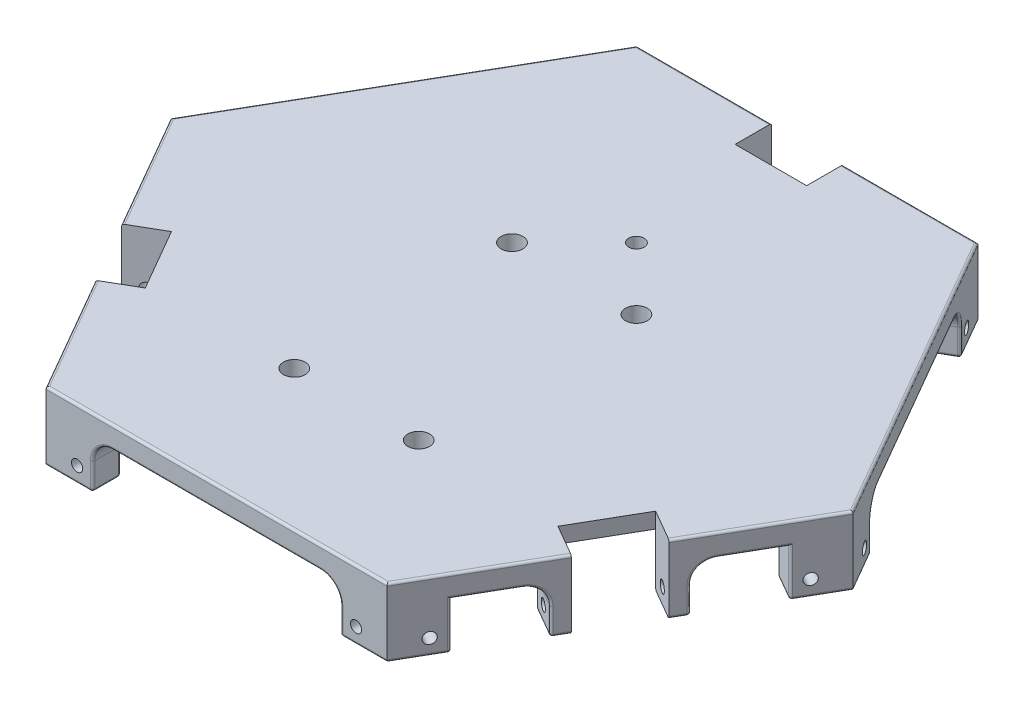
from build123d import *

# Parameters (mm, degrees)
RESSALTO_EXTRUS_O1_DEPTH   = 3
RESSALTO_EXTRUS_O4_DEPTH   = 0.0001
BOSS_EXTRUDE2_DEPTH        = 5
RESSALTO_EXTRUS_O5_DEPTH   = 15
ESBO_O5_R                  = 1.7999999999999936
CORTE_EXTRUS_O1_DEPTH      = 35
PADR_OCIRCULAR1_COUNT      = 3
RESSALTO_EXTRUS_O8_DEPTH   = 15
CORTE_EXTRUS_O2_DEPTH      = 29.00000000000001
CORTE_EXTRUS_O2_DEPTH_BACK = 216.00000000000009
ESBO_O10_R                 = 1.8000000000000007
CORTE_EXTRUS_O3_DEPTH      = 216.00000000000009
CORTE_EXTRUS_O3_DEPTH_BACK = 216.00000000000009
ESBO_O11_R                 = 1.8025814951742
CORTE_EXTRUS_O4_DEPTH      = 216.00000000000009
CORTE_EXTRUS_O4_DEPTH_BACK = 216.00000000000009
ESBO_O12_R                 = 1.80403570182526
CORTE_EXTRUS_O5_DEPTH      = 216.00000000000009
CORTE_EXTRUS_O5_DEPTH_BACK = 216.00000000000009
ESBO_O13_R                 = 1.8049099392984227
CORTE_EXTRUS_O6_DEPTH      = 216.00000000000009
CORTE_EXTRUS_O6_DEPTH_BACK = 216.00000000000009
ESBO_O14_R                 = 1.8000000000000007
CORTE_EXTRUS_O7_DEPTH      = 216.00000000000009
CORTE_EXTRUS_O7_DEPTH_BACK = 216.00000000000009
ESBO_O15_R                 = 1.8000000000000007
BOSS_EXTRUDE3_DEPTH        = 2
FILLET1_R                  = 6.5
FILLET2_R                  = 0.75
FILLET3_R                  = 0.75
ESBO_O16_R                 = 3.500000000000001
ESBO_O16_R_2               = 3.4999999999999996
ESBO_O16_R_3               = 2.500000000000003
CORTE_EXTRUS_O8_DEPTH      = 10


with BuildPart() as part:
    # Esboço1 → Ressalto-extrusão1 (new body)
    with BuildSketch(Plane(origin=(0, 0, 0), x_dir=(1, 0, 0), z_dir=(0, 1, 0))):
        Polygon((-76.52241335952162, -57.459292143521004), (-54.84827557301444, -95.00000000000001), (54.848275573014426, -95.00000000000001), (76.52241335952168, -57.45929214352106), (66.34661486505452, -51.58429214352106), (77.84661486505452, -31.66570785647897), (88.02241335952166, -37.54070785647897), (109.69655114602891, -1.413e-14), (54.848275573014455, 95), (11.499999999999996, 95), (11.49999999999999, 83.25), (-11.50000000000001, 83.25), (-11.499999999999996, 95), (-54.84827557301442, 95), (-109.69655114602888, 1.67e-14), (-88.02241335952161, -37.54070785647894), (-77.84661486505446, -31.665707856478924), (-66.34661486505448, -51.58429214352102), align=None)
    extrude(amount=RESSALTO_EXTRUS_O1_DEPTH)

    # Esboço3 → Ressalto-extrusão4 (add)
    with BuildSketch(Plane(origin=(0, 3, 0), x_dir=(1, 0, 0), z_dir=(0, 1, 0))):
        Polygon((-66.34661486505448, -51.58429214352102), (-60.28443703856341, -48.084292143521004), (-63.284437038563446, -42.88813972081439), (-69.34661486505445, -46.3881397208144), align=None)
        Polygon((-77.84661486505446, -31.665707856478924), (-71.78443703856347, -28.165707856478917), (-68.78443703856344, -33.36186027918553), (-74.84661486505446, -36.86186027918555), align=None)
        Polygon((-11.50000000000001, 83.25), (-11.500000000000009, 75.25000000000001), (-5.500000000000008, 75.25000000000003), (-5.500000000000008, 83.25), align=None)
        Polygon((11.49999999999999, 83.25), (11.499999999999991, 75.25000000000001), (5.499999999999991, 75.25000000000003), (5.499999999999992, 83.25), align=None)
        Polygon((66.34661486505452, -51.58429214352106), (59.418411634779005, -47.58429214352107), (62.418411634779005, -42.38813972081444), (69.34661486505452, -46.388139720814436), align=None)
        Polygon((77.8466148650545, -31.665707856478967), (70.91841163477902, -27.665707856478974), (67.91841163477903, -32.8618602791856), (74.84661486505455, -36.86186027918559), align=None)
    extrude(amount=-RESSALTO_EXTRUS_O4_DEPTH)

    # Sketch5 → Boss-Extrude2 (add)
    with BuildSketch(Plane(origin=(0, 3, 0), x_dir=(1, 0, 0), z_dir=(0, 1, 0))):
        Polygon((77.84661486505452, -31.66570785647897), (88.02241335952166, -37.54070785647897), (109.69655114602891, -1.413e-14), (54.848275573014455, 95), (11.499999999999996, 95), (11.49999999999999, 83.25), (20.499999999999996, 83.25), (20.499999999999996, 86), (49.65212315030783, 86), (99.30424630061566, -1.691e-14), (84.72818472546173, -25.246479222419026), (82.34661486505452, -23.871479222419023), align=None)
        Polygon((-11.50000000000001, 83.25), (-11.499999999999996, 95), (-54.84827557301442, 95), (-109.69655114602888, 1.67e-14), (-88.02241335952161, -37.54070785647894), (-77.84661486505446, -31.665707856478924), (-82.34661486505449, -23.871479222418984), (-84.72818472546165, -25.246479222418962), (-99.30424630061557, -4.337e-14), (-49.6521231503078, 86), (-20.50000000000001, 86), (-20.50000000000001, 83.25), align=None)
        Polygon((-66.34661486505448, -51.58429214352102), (-76.52241335952162, -57.459292143521004), (-54.84827557301444, -95.00000000000001), (54.848275573014426, -95.00000000000001), (76.52241335952168, -57.45929214352106), (66.34661486505452, -51.58429214352106), (61.84661486505451, -59.378520777580995), (64.22818472546174, -60.75352077758099), (49.65212315030781, -86.00000000000001), (-49.6521231503078, -86.00000000000001), (-64.22818472546169, -60.75352077758097), (-61.84661486505446, -59.37852077758095), align=None)
    extrude(amount=-BOSS_EXTRUDE2_DEPTH)

    # Esboço4 → Ressalto-extrusão5 (add)
    with BuildSketch(Plane.XZ.offset(2)):
        Polygon((-76.52241335952162, 57.45929214352102), (-74.02241335952165, 61.78941916244322), (-63.846614865054484, 55.91441916244322), (-66.34661486505448, 51.58429214352102), align=None)
        Polygon((-77.84661486505448, 31.665707856478917), (-88.02241335952162, 37.54070785647897), (-90.52241335952166, 33.21058083755671), (-80.34661486505449, 27.3355808375567), align=None)
    ressalto_extrus_o5 = extrude(amount=RESSALTO_EXTRUS_O5_DEPTH)

    # Esboço5 → Corte-extrusão1 (cut)
    with BuildSketch(Plane(origin=(-8.250000000000057, 0, -14.289419162443316), x_dir=(-0.8660254037844386, 0, 0.5000000000000003), z_dir=(-0.5000000000000002, 0, -0.8660254037844385))):
        with Locations((89.12499999999996, -12)):
            Circle(ESBO_O5_R)
    corte_extrus_o1 = extrude(amount=-CORTE_EXTRUS_O1_DEPTH, mode=Mode.SUBTRACT)

    # PadrãoCircular1: Ressalto-extrusão5, Corte-extrusão1 ×3 about axis
    padr_ocircular1_axis = Axis((0, 0, 0), (0, -1, 0))
    add([ressalto_extrus_o5.rotate(padr_ocircular1_axis, i * 360 / PADR_OCIRCULAR1_COUNT) for i in range(1, PADR_OCIRCULAR1_COUNT)])
    add([corte_extrus_o1.rotate(padr_ocircular1_axis, i * 360 / PADR_OCIRCULAR1_COUNT) for i in range(1, PADR_OCIRCULAR1_COUNT)], mode=Mode.SUBTRACT)

    # Esboço9 → Ressalto-extrusão8 (add)
    with BuildSketch(Plane.XZ.offset(2)):
        Polygon((-54.84827557301444, 95.00000000000001), (-39.84827557301444, 95.00000000000001), (-39.84827557301444, 86.00000000000001), (-49.65212315030776, 86.00000000000001), (-54.55404693895444, 77.50961894323342), (-62.34827557301441, 82.00961894323343), align=None)
        Polygon((54.848275573014426, 95.00000000000001), (62.34827557301445, 82.00961894323342), (54.55404693895453, 77.50961894323342), (49.65212315030783, 86.00000000000001), (39.84827557301443, 86.00000000000001), (39.84827557301443, 95.00000000000001), align=None)
        Polygon((109.69655114602891, 1.413e-14), (102.1965511460289, 12.990381056766584), (94.40232251196895, 8.490381056766584), (99.30424630061572, -9.085e-14), (94.40232251196873, -8.490381056767017), (102.19655114602891, -12.990381056766573), align=None)
        Polygon((54.848275573014455, -95), (39.84827557301443, -95), (39.84827557301443, -86.00000000000001), (49.65212315030783, -86.00000000000003), (54.554046938954514, -77.5096189432334), (62.34827557301446, -82.00961894323342), align=None)
        Polygon((-54.84827557301442, -95), (-62.34827557301441, -82.00961894323345), (-54.554046938954414, -77.5096189432334), (-49.65212315030775, -86.00000000000001), (-39.84827557301444, -86.00000000000001), (-39.84827557301444, -95), align=None)
        Polygon((-109.69655114602888, -1.67e-14), (-102.19655114602885, 12.99038105676659), (-94.40232251196892, 8.490381056766584), (-99.30424630061563, -1.664e-14), (-94.40232251196892, -8.490381056767017), (-102.19655114602868, -12.990381056766926), align=None)
    extrude(amount=RESSALTO_EXTRUS_O8_DEPTH)

    # Esboço10 → Corte-extrusão2 (cut, two sides: drawn at the far end of the back side and taken through both)
    with BuildSketch(Plane.XY.offset(95.00000000000001).offset(-CORTE_EXTRUS_O2_DEPTH_BACK)):
        with Locations((44.848275573014426, -12)):
            Circle(ESBO_O10_R)
    extrude(amount=CORTE_EXTRUS_O2_DEPTH + CORTE_EXTRUS_O2_DEPTH_BACK, mode=Mode.SUBTRACT)

    # Esboço11 → Corte-extrusão3 (cut, two sides: drawn at the far end of the back side and taken through both)
    with BuildSketch(Plane(origin=(82.27241335952168, 0, 47.50000000000006), x_dir=(0.5000000000000006, 0, -0.8660254037844384), z_dir=(0.8660254037844384, 0, 0.5000000000000006)).offset(-CORTE_EXTRUS_O3_DEPTH_BACK)):
        with Locations((-44.84827557301439, -12)):
            Circle(ESBO_O11_R)
    extrude(amount=CORTE_EXTRUS_O3_DEPTH + CORTE_EXTRUS_O3_DEPTH_BACK, mode=Mode.SUBTRACT)

    # Esboço12 → Corte-extrusão4 (cut, two sides: drawn at the far end of the back side and taken through both)
    with BuildSketch(Plane(origin=(82.27241335952168, 0, 47.500000000000064), x_dir=(0.5000000000000007, 0, -0.8660254037844383), z_dir=(0.8660254037844383, 0, 0.5000000000000007)).offset(-CORTE_EXTRUS_O4_DEPTH_BACK)):
        with Locations((44.8482755730145, -12)):
            Circle(ESBO_O12_R)
    extrude(amount=CORTE_EXTRUS_O4_DEPTH + CORTE_EXTRUS_O4_DEPTH_BACK, mode=Mode.SUBTRACT)

    # Esboço13 → Corte-extrusão5 (cut, two sides: drawn at the far end of the back side and taken through both)
    with BuildSketch(Plane(origin=(82.27241335952168, 0, -47.50000000000001), x_dir=(-0.5, 0, -0.8660254037844386), z_dir=(0.8660254037844387, 0, -0.5000000000000001)).offset(-CORTE_EXTRUS_O5_DEPTH_BACK)):
        with Locations((-44.84827557301447, -12)):
            Circle(ESBO_O13_R)
    extrude(amount=CORTE_EXTRUS_O5_DEPTH + CORTE_EXTRUS_O5_DEPTH_BACK, mode=Mode.SUBTRACT)

    # Esboço14 → Corte-extrusão6 (cut, two sides: drawn at the far end of the back side and taken through both)
    with BuildSketch(Plane(origin=(82.27241335952168, 0, -47.50000000000001), x_dir=(-0.5, 0, -0.8660254037844386), z_dir=(0.8660254037844387, 0, -0.5000000000000001)).offset(-CORTE_EXTRUS_O6_DEPTH_BACK)):
        with Locations((44.84827557301444, -12)):
            Circle(ESBO_O14_R)
    extrude(amount=CORTE_EXTRUS_O6_DEPTH + CORTE_EXTRUS_O6_DEPTH_BACK, mode=Mode.SUBTRACT)

    # Esboço15 → Corte-extrusão7 (cut, two sides: drawn at the far end of the back side and taken through both)
    with BuildSketch(Plane(origin=(0, 0, -95), x_dir=(-1, 0, 0), z_dir=(0, 0, -1)).offset(-CORTE_EXTRUS_O7_DEPTH_BACK)):
        with Locations((44.84827557301443, -12)):
            Circle(ESBO_O15_R)
    extrude(amount=CORTE_EXTRUS_O7_DEPTH + CORTE_EXTRUS_O7_DEPTH_BACK, mode=Mode.SUBTRACT)

    # Sketch6 → Boss-Extrude3 (add)
    with BuildSketch(Plane(origin=(0, 3, 0), x_dir=(1, 0, 0), z_dir=(0, 1, 0))):
        Polygon((-77.84661486505446, -31.665707856478924), (-66.34661486505448, -51.58429214352102), (-76.52241335952162, -57.459292143521004), (-54.84827557301444, -95.00000000000001), (54.848275573014426, -95.00000000000001), (76.52241335952168, -57.45929214352106), (66.34661486505452, -51.58429214352106), (77.84661486505452, -31.66570785647897), (88.02241335952166, -37.54070785647897), (109.69655114602891, -1.413e-14), (54.848275573014455, 95), (11.499999999999996, 95), (11.49999999999999, 83.25), (-11.50000000000001, 83.25), (-11.499999999999996, 95), (-54.84827557301442, 95), (-109.69655114602888, 1.67e-14), (-88.02241335952161, -37.54070785647894), align=None)
    extrude(amount=BOSS_EXTRUDE3_DEPTH)

    # Fillet1
    fillet1_edges = [part.edges().sort_by_distance(p)[0] for p in [
        (-85.43451411228807, -2, 30.273080837556705),
        (-98.29943682899889, -2, 10.740381056766587),
        (-98.29943682899881, -2, -10.74038105676697),
        (-58.45116125598442, -2, -79.75961894323342),
        (-39.84827557301444, -2, -90.5),
        (-16.500000000000014, -2, -89.12499999999996),
        (58.45116125598449, -2, -79.75961894323342),
        (16.500000000000014, -2, -89.12499999999994),
        (39.84827557301443, -2, -90.5),
        (98.29943682899882, -2, -10.740381056766795),
        (85.43451411228807, -2, 30.273080837556705),
        (-39.84827557301444, -2, 90.50000000000001),
        (39.84827557301443, -2, 90.50000000000001),
        (-58.451161255984424, -2, 79.75961894323342),
        (-68.93451411228807, -2, 58.85191916244322),
        (68.93451411228806, -2, 58.85191916244321),
    ]]
    fillet(fillet1_edges, radius=FILLET1_R)

    # Fillet2
    fillet2_edges = [part.edges().sort_by_distance(p)[0] for p in [
        (-102.19655114602885, -12.75, 12.99038105676659),
        (-101.24464818488512, -3.9038059222874413, 14.63912534934277),
        (-96.35948225277525, -2, 23.100480947161643),
        (-90.52241335952166, -12.75, 33.21058083755671),
        (-74.02241335952165, -12.75, 61.78941916244322),
        (-73.07051039837792, -3.9038059222874413, 63.438163455019385),
        (-62.34827557301441, -12.75, 82.00961894323343),
        (-63.30017853415812, -3.9038059222874404, 80.36087465065725),
        (102.19655114602891, -12.75, -12.990381056766573),
        (101.24464818488497, -3.9038059222874404, -14.639125349342624),
        (62.34827557301446, -12.75, -82.00961894323342),
        (63.300178534158164, -3.903805922287443, -80.36087465065722),
        (39.84827557301443, -12.75, -95),
        (37.944469650726994, -3.9038059222874404, -95),
        (16.500000000000018, -12.75, -94.99999999999997),
        (18.40380592228746, -3.9038059222874404, -95),
        (94.40232251196873, -12.75, -8.490381056767017),
        (93.45041955082478, -3.9038059222874404, -10.139125349343065),
        (74.47818472546162, -2, -43.000000000000206),
        (55.50594990009824, -3.9038059222874404, -75.86087465065722),
        (39.84827557301443, -12.75, -86.00000000000001),
        (37.944469650726994, -3.9038059222874404, -86),
        (28.17413778650722, -2, -86),
        (16.500000000000018, -12.75, -83.24999999999994),
        (-16.500000000000007, -12.75, -94.99999999999996),
        (-18.403805922287447, -3.9038059222874413, -95),
        (-39.84827557301444, -12.75, -95),
        (-37.944469650727, -3.9038059222874386, -95),
        (-39.84827557301444, -12.75, -86.00000000000001),
        (-37.944469650727, -3.9038059222874413, -86),
        (-28.174137786507224, -2, -86),
        (-16.500000000000018, -12.75, -83.24999999999994),
        (-62.34827557301441, -12.75, -82.00961894323345),
        (-63.300178534158135, -3.903805922287443, -80.36087465065727),
        (-82.27241335952155, -2, -47.50000000000019),
        (-102.19655114602868, -12.75, -12.990381056766926),
        (-94.40232251196892, -12.75, -8.490381056767017),
        (-54.554046938954414, -12.75, -77.5096189432334),
        (-55.505949900098166, -3.903805922287443, -75.86087465065724),
        (-74.47818472546157, -2, -43.00000000000017),
        (-94.40232251196892, -12.75, 8.490381056766584),
        (-93.45041955082517, -3.9038059222874413, 10.139125349342752),
        (-88.56525361871527, -2, 18.60048094716163),
        (-80.34661486505449, -12.75, 27.3355808375567),
        (-63.846614865054484, -12.75, 55.91441916244322),
        (-54.55404693895444, -12.75, 77.50961894323342),
        (-55.50594990009818, -3.903805922287437, 75.86087465065725),
        (-63.6155621646608, -2.126225608009019, 61.814614178751086),
        (39.84827557301443, -12.75, 86.00000000000001),
        (-39.84827557301444, -12.75, 86.00000000000001),
        (-37.944469650727, -3.9038059222874413, 86.00000000000001),
        (0, -2, 86.00000000000001),
        (63.61556216466084, -2.1262256080090207, 61.81461417875111),
        (63.30077832165249, -4.894448724535993, 56.859835788243295),
        (80.89245140845655, -4.894448724536039, 26.390164211756698),
        (90.52241335952166, -12.75, 33.210580837556705),
        (91.47431632066541, -3.9038059222874413, 31.561836544980544),
        (-39.84827557301444, -12.75, 95.00000000000001),
        (-37.944469650727, -3.9038059222874413, 95.00000000000001),
        (-7.11e-15, -2, 95.00000000000001),
        (37.944469650726994, -3.9038059222874404, 95.00000000000001),
        (66.56034446626806, -2, 74.71410161513775),
        (73.07051039837798, -3.903805922287445, 63.43816345501943),
        (-44.7501993616611, -17, 86.00000000000001),
        (-52.1030850446311, -17, 81.75480947161671),
        (-96.85328440629227, -17, -4.245190528383517),
        (-96.85328440629227, -17, 4.245190528383284),
        (44.75019936166113, -17, -86.00000000000003),
        (52.10308504463117, -17, -81.75480947161671),
        (-52.10308504463109, -17, -81.75480947161671),
        (-44.750199361661096, -17, -86.00000000000001),
        (96.85328440629223, -17, -4.245190528383554),
        (96.85328440629233, -17, 4.2451905283832465),
        (52.10308504463118, -17, 81.75480947161671),
        (44.75019936166113, -17, 86.00000000000001),
        (-91.47431632066534, -3.903805922287436, 31.5618365449805),
        (-68.18534446626802, -2, 71.89951905283831),
        (82.27241335952168, -2, -47.49999999999999),
        (28.174137786507224, -2, -95),
        (54.554046938954514, -12.75, -77.5096189432334),
        (21.725245121601812, -2.1262256080090207, -86),
        (20.499999999999996, -2.500000000000009, -84.625),
        (17.59167308680403, -4.894448724536022, -83.25),
        (14.000000000000004, -17, -83.24999999999994),
        (-14.000000000000014, -17, -83.24999999999994),
        (-28.17413778650722, -2, -95),
        (-20.500000000000014, -2.499999999999999, -84.625),
        (-21.725245121601816, -2.126225608009019, -86),
        (-17.591673086804025, -4.894448724536015, -83.25),
        (-101.24464818488497, -3.903805922287443, -14.639125349343114),
        (-93.45041955082496, -3.9038059222874404, -10.13912534934307),
        (-85.34080728626255, -2.1262256080090225, 24.185385821248833),
        (-83.53739979525805, -2.5000000000000266, 24.558979222419),
        (-80.89245140845651, -4.894448724536027, 26.390164211756673),
        (-63.03739979525807, -2.499999999999991, 60.066020777580974),
        (-63.30077832165246, -4.894448724536001, 56.85983578824326),
        (-60.39111583220808, -2, 67.39951905283831),
        (37.944469650726994, -3.9038059222874404, 86.00000000000001),
        (54.55404693895453, -9.5, 77.50961894323342),
        (58.76611583220812, -2, 70.21410161513775),
        (63.037399795258175, -2.500000000000033, 60.066020777580924),
        (63.84661486505448, -12.75, 55.91441916244321),
        (80.34661486505449, -12.75, 27.335580837556698),
        (62.34827557301445, -9.5, 82.00961894323342),
        (97.98448225277531, -2, 20.285898384862232),
        (102.1965511460289, -9.5, 12.990381056766584),
        (39.84827557301443, -12.75, 95.00000000000001),
        (74.02241335952166, -12.75, 61.789419162443224),
        (-65.09661486505448, -17, 53.74935565298212),
        (-79.09661486505448, -17, 29.50064434701781),
        (65.09661486505448, -17, 53.74935565298209),
        (79.09661486505449, -17, 29.500644347017793),
        (-89.27241335952165, -17, 35.37564434701784),
        (-75.27241335952164, -17, 59.62435565298212),
        (-47.34827557301444, -17, 95.00000000000001),
        (-58.598275573014426, -17, 88.50480947161672),
        (47.34827557301443, -17, 95.00000000000001),
        (58.59827557301443, -17, 88.50480947161671),
        (75.27241335952168, -17, 59.62435565298209),
        (89.27241335952165, -17, 35.3756443470178),
        (105.9465511460289, -17, 6.495190528383299),
        (105.94655114602891, -17, -6.495190528383279),
        (58.59827557301446, -17, -88.50480947161671),
        (13.999999999999982, -17, -94.99999999999997),
        (-14.000000000000014, -17, -94.99999999999994),
        (47.34827557301445, -17, -95),
        (-105.94655114602887, -17, 6.4951905283832865),
        (-105.94655114602878, -17, -6.495190528383471),
        (-58.59827557301441, -17, -88.50480947161672),
        (-47.34827557301443, -17, -95),
        (-98.85948225277525, 5, 18.77035392823946),
        (-65.68534446626803, 5, 76.22964607176051),
        (-7.11e-15, 5, 95.00000000000001),
        (65.68534446626805, 5, 76.22964607176054),
        (98.85948225277528, 5, 18.77035392823949),
        (82.27241335952168, 5, -47.49999999999999),
        (33.174137786507224, 5, -95),
        (-33.1741377865072, 5, -95),
        (-82.27241335952165, 5, -47.50000000000001),
        (-98.29943682899881, -17, -10.74038105676697),
        (-98.29943682899889, -17, 10.740381056766587),
        (-58.45116125598442, -17, -79.75961894323342),
        (-39.84827557301444, -17, -90.5),
        (-16.500000000000014, -17, -89.12499999999996),
        (16.500000000000014, -17, -89.12499999999994),
        (39.84827557301443, -17, -90.5),
        (58.45116125598449, -17, -79.75961894323342),
        (98.29943682899882, -17, -10.740381056766795),
        (98.29943682899892, -17, 10.740381056766584),
        (85.43451411228807, -17, 30.273080837556705),
        (68.93451411228806, -17, 58.85191916244321),
        (58.45116125598449, -17, 79.75961894323342),
        (39.84827557301443, -17, 90.50000000000001),
        (-39.84827557301444, -17, 90.50000000000001),
        (-58.451161255984424, -17, 79.75961894323342),
        (-68.93451411228807, -17, 58.85191916244322),
        (-85.43451411228807, -17, 30.273080837556705),
    ]]
    fillet(fillet2_edges, radius=FILLET2_R)

    # Fillet3
    fillet3_edges = [part.edges().sort_by_distance(p)[0] for p in [
        (15.999999999999993, 0, -83.25),
        (20.499999999999996, 0, -84.625),
        (35.076061575153915, 0, -86),
        (-20.50000000000001, 0, -84.625),
        (-16.00000000000001, 0, -83.25),
        (-35.07606157515391, 0, -86),
        (-74.47818472546169, 0, -42.99999999999998),
        (-83.53739979525807, 0, 24.55897922241898),
        (-92.01621551303862, 0, 12.623239611209499),
        (-80.09661486505449, -4.4e-16, 27.768593539448958),
        (-63.03739979525807, 0, 60.06602077758095),
        (-56.940153937884745, 0, 73.37676038879049),
        (-64.09661486505449, 0, 55.48140646055099),
        (63.03739979525813, 0, 60.06602077758099),
        (7.11e-15, 0, 86.00000000000001),
        (56.94015393788478, 0, 73.37676038879052),
        (64.09661486505452, 0, 55.481406460551035),
        (80.09661486505453, 0, 27.768593539449),
        (83.53739979525812, 0, 24.55897922241902),
        (74.47818472546176, -4.4e-16, -42.99999999999999),
        (92.0162155130387, 0, 12.623239611209526),
    ]]
    fillet(fillet3_edges, radius=FILLET3_R)

    # Esboço16 → Corte-extrusão8 (cut)
    with BuildSketch(Plane(origin=(0, 5, 0), x_dir=(1, 0, 0), z_dir=(0, 1, 0))):
        with Locations((20.000000000000004, -50.000000000000014)):
            Circle(ESBO_O16_R)
        with Locations((20, 19.99999999999999)):
            Circle(ESBO_O16_R_2)
        with Locations((-20, 19.99999999999999)):
            Circle(ESBO_O16_R_2)
        with Locations((-20.000000000000004, -50.000000000000014)):
            Circle(ESBO_O16_R)
        with Locations((0, 39.99999999999999)):
            Circle(ESBO_O16_R_3)
    extrude(amount=-CORTE_EXTRUS_O8_DEPTH, mode=Mode.SUBTRACT)


solid = part.part
